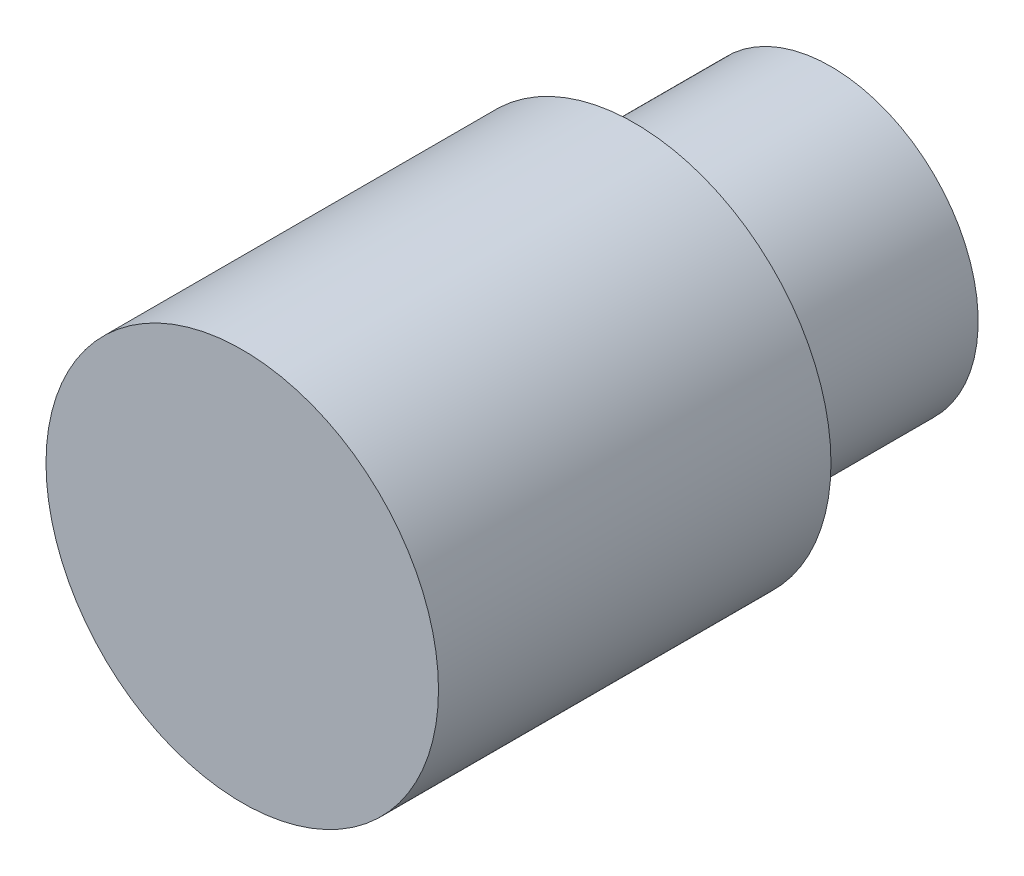
from build123d import *

# Parameters (mm, degrees)
SKETCH2_W           = 100
SKETCH2_H           = 50
SKETCH5_R           = 37.5
BOSS_EXTRUDE1_DEPTH = 50


with BuildPart() as part:
    # Sketch2 → Revolve1 (revolve)
    with BuildSketch(Plane(origin=(0, 0, 0), x_dir=(0, 0, -1), z_dir=(1, 0, 0)), mode=Mode.PRIVATE) as revolve1_sk:
        with Locations((50, -25)):
            Rectangle(SKETCH2_W, SKETCH2_H)
    revolve(revolve1_sk.sketch.rotate(Axis((0, 0, 0), (0, 0, -1)), 270), axis=Axis((0, 0, 0), (0, 0, -1)))

    # Sketch5 → Boss-Extrude1 (add)
    with BuildSketch(Plane(origin=(0, 0, -100), x_dir=(-1, 0, 0), z_dir=(0, 0, -1))):
        Circle(SKETCH5_R)
    extrude(amount=BOSS_EXTRUDE1_DEPTH)


solid = part.part
